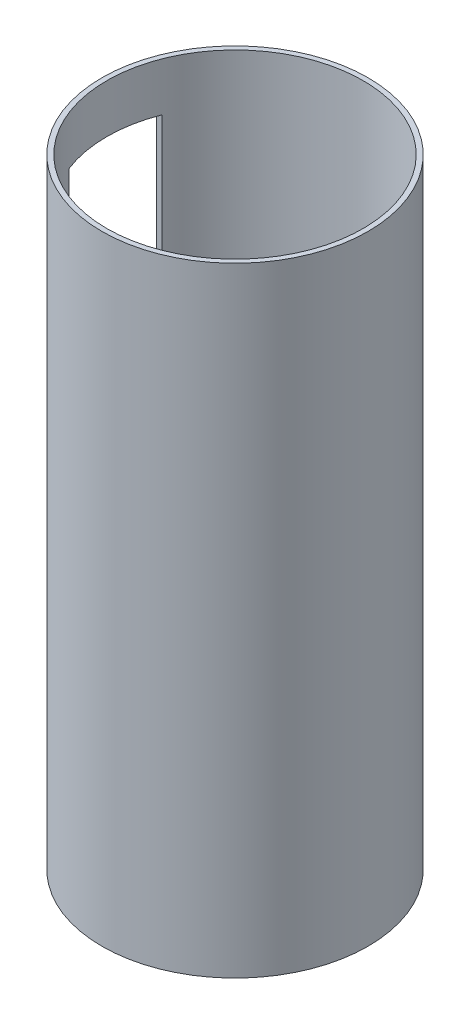
from build123d import *

# Parameters (mm, degrees)
SKETCH1_R           = 21.5
SKETCH1_R_2         = 20.7
BOSS_EXTRUDE1_DEPTH = 100
SKETCH2_W           = 15
SKETCH2_H           = 40
CUT_EXTRUDE1_DEPTH  = 100


with BuildPart() as part:
    # Sketch1 → Boss-Extrude1 (new body)
    with BuildSketch(Plane(origin=(0, 0, 0), x_dir=(1, 0, 0), z_dir=(0, 1, 0))):
        with Locations(Location((0, 0, 0), (0, 0, 270))):
            Circle(SKETCH1_R)
        with Locations(Location((0, 0, 0), (0, 0, 270))):
            Circle(SKETCH1_R_2, mode=Mode.SUBTRACT)
    extrude(amount=BOSS_EXTRUDE1_DEPTH)

    # Sketch2 → Cut-Extrude1 (cut)
    with BuildSketch(Plane(origin=(0, 0, 0), x_dir=(0, 0, -1), z_dir=(1, 0, 0))):
        with Locations((0, 72.162163313)):
            Rectangle(SKETCH2_W, SKETCH2_H)
    extrude(amount=-CUT_EXTRUDE1_DEPTH, mode=Mode.SUBTRACT)


solid = part.part
